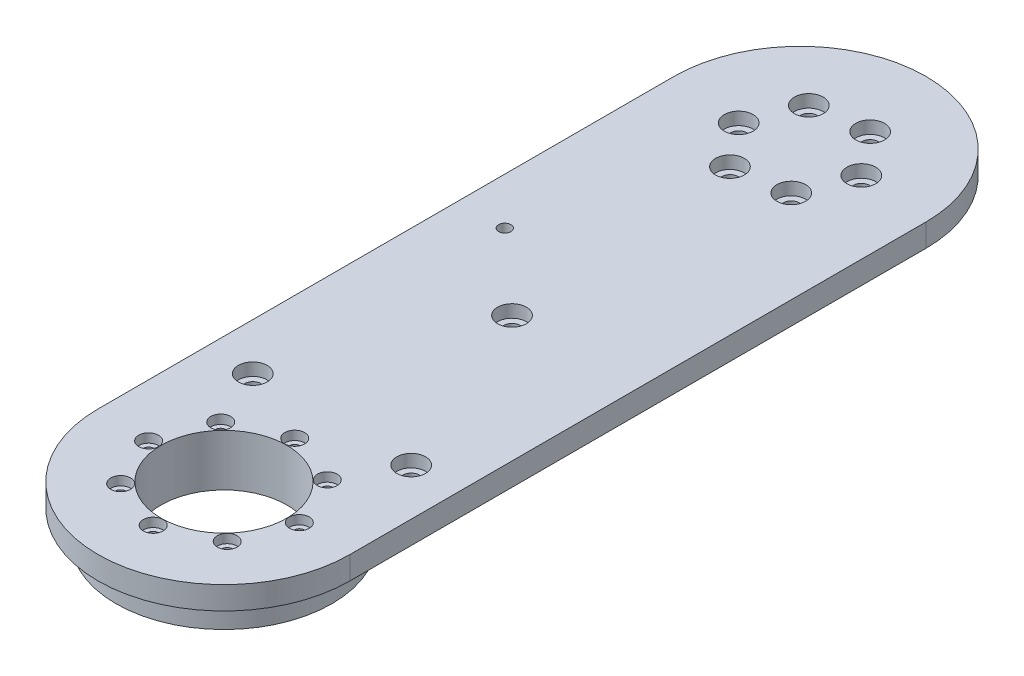
from build123d import *

# Parameters (mm, degrees)
PLACA_START                    = 46.75
SK_PLACA_W                     = 70
SK_PLACA_H                     = 160
PLACA_DEPTH                    = 6.35
EXTREMOS_START                 = 46.75
SK_EXTREMOS_R                  = 35
EXTREMOS_DEPTH                 = 6.35
PASANTES_M4_SEPARADORES_START  = 46.75
SK_PASANTES_M4_SEPARADORES_R   = 2.25
PASANTES_M4_SEPARADORES_DEPTH  = 6.35
ASIENTO_J3_START               = 38.75
SK_ASIENTO_J3_R                = 30
SK_ASIENTO_J3_R_2              = 17.5
ASIENTO_J3_DEPTH               = 8
PASO_ROTOR_J3_START            = 38.75
SK_PASO_ROTOR_J3_R             = 17.5
PASO_ROTOR_J3_DEPTH            = 14.35
PASANTES_M2_5_ESTATOR_J3_START = 38.75
SK_PASANTES_M2_5_ESTATOR_J3_R  = 1.45
PASANTES_M2_5_ESTATOR_J3_DEPTH = 14.35
CAJAS_M2_5_J3_START            = 50.6
SK_CAJAS_M2_5_J3_R             = 2.75
CAJAS_M2_5_J3_DEPTH            = 2.5
PASANTES_M4_SALIDA_J2_START    = 46.75
SK_PASANTES_M4_SALIDA_J2_R     = 2.25
PASANTES_M4_SALIDA_J2_DEPTH    = 6.35
CAJAS_M4_J2_START              = 49.6
SK_CAJAS_M4_J2_R               = 4
CAJAS_M4_J2_DEPTH              = 3.5
PASANTE_M3_CINCHO_START        = 46.75
SK_PASANTE_M3_CINCHO_R         = 1.7
PASANTE_M3_CINCHO_DEPTH        = 6.35
SK_CAJAS_M4_SEPARADORES_R      = 4
CAJAS_M4_SEPARADORES_DEPTH     = 3.5


with BuildPart() as part:
    # Sk_Placa → Placa (new body)
    with BuildSketch(Plane(origin=(0, 0, 0), x_dir=(1, 0, 0), z_dir=(0, 1, 0)).offset(PLACA_START)):
        with Locations((0, -250)):
            Rectangle(SK_PLACA_W, SK_PLACA_H)
    extrude(amount=PLACA_DEPTH)

    # Sk_Extremos → Extremos (add)
    with BuildSketch(Plane(origin=(0, 0, 0), x_dir=(1, 0, 0), z_dir=(0, 1, 0)).offset(EXTREMOS_START)):
        with Locations((0, -170)):
            Circle(SK_EXTREMOS_R)
        with Locations((0, -330)):
            Circle(SK_EXTREMOS_R)
    extrude(amount=EXTREMOS_DEPTH)

    # Sk_Pasantes_M4_separadores → Pasantes_M4_separadores (cut)
    with BuildSketch(Plane(origin=(0, 0, 0), x_dir=(1, 0, 0), z_dir=(0, 1, 0)).offset(PASANTES_M4_SEPARADORES_START)):
        with Locations(Location((0, -250, 0), (0, 0, 270))):
            Circle(SK_PASANTES_M4_SEPARADORES_R)
        with Locations(Location((-22, -300, 0), (0, 0, 270))):
            Circle(SK_PASANTES_M4_SEPARADORES_R)
        with Locations(Location((22, -300, 0), (0, 0, 270))):
            Circle(SK_PASANTES_M4_SEPARADORES_R)
    extrude(amount=PASANTES_M4_SEPARADORES_DEPTH, mode=Mode.SUBTRACT)

    # Sk_Asiento_J3 → Asiento_J3 (add)
    with BuildSketch(Plane(origin=(0, 0, 0), x_dir=(1, 0, 0), z_dir=(0, 1, 0)).offset(ASIENTO_J3_START)):
        with Locations(Location((0, -330, 0), (0, 0, 270))):
            Circle(SK_ASIENTO_J3_R)
        with Locations(Location((0, -330, 0), (0, 0, 270))):
            Circle(SK_ASIENTO_J3_R_2, mode=Mode.SUBTRACT)
    extrude(amount=ASIENTO_J3_DEPTH)

    # Sk_Paso_rotor_J3 → Paso_rotor_J3 (cut)
    with BuildSketch(Plane(origin=(0, 0, 0), x_dir=(1, 0, 0), z_dir=(0, 1, 0)).offset(PASO_ROTOR_J3_START)):
        with Locations(Location((0, -330, 0), (0, 0, 270))):
            Circle(SK_PASO_ROTOR_J3_R)
    extrude(amount=PASO_ROTOR_J3_DEPTH, mode=Mode.SUBTRACT)

    # Sk_Pasantes_M2-5_estator_J3 → Pasantes_M2-5_estator_J3 (cut)
    with BuildSketch(Plane(origin=(0, 0, 0), x_dir=(1, 0, 0), z_dir=(0, 1, 0)).offset(PASANTES_M2_5_ESTATOR_J3_START)):
        with Locations(Location((20.289983175, -329.362361591, 0), (0, 0, 270))):
            Circle(SK_PASANTES_M2_5_ESTATOR_J3_R)
        with Locations(Location((14.798063137, -343.89630625, 0), (0, 0, 270))):
            Circle(SK_PASANTES_M2_5_ESTATOR_J3_R)
        with Locations(Location((0.637638409, -350.289983175, 0), (0, 0, 270))):
            Circle(SK_PASANTES_M2_5_ESTATOR_J3_R)
        with Locations(Location((-13.89630625, -344.798063137, 0), (0, 0, 270))):
            Circle(SK_PASANTES_M2_5_ESTATOR_J3_R)
        with Locations(Location((-20.289983175, -330.637638409, 0), (0, 0, 270))):
            Circle(SK_PASANTES_M2_5_ESTATOR_J3_R)
        with Locations(Location((-14.798063137, -316.10369375, 0), (0, 0, 270))):
            Circle(SK_PASANTES_M2_5_ESTATOR_J3_R)
        with Locations(Location((-0.637638409, -309.710016825, 0), (0, 0, 270))):
            Circle(SK_PASANTES_M2_5_ESTATOR_J3_R)
        with Locations(Location((13.89630625, -315.201936863, 0), (0, 0, 270))):
            Circle(SK_PASANTES_M2_5_ESTATOR_J3_R)
    extrude(amount=PASANTES_M2_5_ESTATOR_J3_DEPTH, mode=Mode.SUBTRACT)

    # Sk_Cajas_M2-5_J3 → Cajas_M2-5_J3 (cut)
    with BuildSketch(Plane(origin=(0, 0, 0), x_dir=(1, 0, 0), z_dir=(0, 1, 0)).offset(CAJAS_M2_5_J3_START)):
        with Locations(Location((20.289983175, -329.362361591, 0), (0, 0, 270))):
            Circle(SK_CAJAS_M2_5_J3_R)
        with Locations(Location((14.798063137, -343.89630625, 0), (0, 0, 270))):
            Circle(SK_CAJAS_M2_5_J3_R)
        with Locations(Location((0.637638409, -350.289983175, 0), (0, 0, 270))):
            Circle(SK_CAJAS_M2_5_J3_R)
        with Locations(Location((-13.89630625, -344.798063137, 0), (0, 0, 270))):
            Circle(SK_CAJAS_M2_5_J3_R)
        with Locations(Location((-20.289983175, -330.637638409, 0), (0, 0, 270))):
            Circle(SK_CAJAS_M2_5_J3_R)
        with Locations(Location((-14.798063137, -316.10369375, 0), (0, 0, 270))):
            Circle(SK_CAJAS_M2_5_J3_R)
        with Locations(Location((-0.637638409, -309.710016825, 0), (0, 0, 270))):
            Circle(SK_CAJAS_M2_5_J3_R)
        with Locations(Location((13.89630625, -315.201936863, 0), (0, 0, 270))):
            Circle(SK_CAJAS_M2_5_J3_R)
    extrude(amount=CAJAS_M2_5_J3_DEPTH, mode=Mode.SUBTRACT)

    # Sk_Pasantes_M4_salida_J2 → Pasantes_M4_salida_J2 (cut)
    with BuildSketch(Plane(origin=(0, 0, 0), x_dir=(1, 0, 0), z_dir=(0, 1, 0)).offset(PASANTES_M4_SALIDA_J2_START)):
        with Locations(Location((14.839084994, -167.808754572, 0), (0, 0, 270))):
            Circle(SK_PASANTES_M4_SALIDA_J2_R)
        with Locations(Location((9.317216704, -181.75540186, 0), (0, 0, 270))):
            Circle(SK_PASANTES_M4_SALIDA_J2_R)
        with Locations(Location((-5.52186829, -183.946647288, 0), (0, 0, 270))):
            Circle(SK_PASANTES_M4_SALIDA_J2_R)
        with Locations(Location((-14.839084994, -172.191245428, 0), (0, 0, 270))):
            Circle(SK_PASANTES_M4_SALIDA_J2_R)
        with Locations(Location((-9.317216704, -158.24459814, 0), (0, 0, 270))):
            Circle(SK_PASANTES_M4_SALIDA_J2_R)
        with Locations(Location((5.52186829, -156.053352712, 0), (0, 0, 270))):
            Circle(SK_PASANTES_M4_SALIDA_J2_R)
    extrude(amount=PASANTES_M4_SALIDA_J2_DEPTH, mode=Mode.SUBTRACT)

    # Sk_Cajas_M4_J2 → Cajas_M4_J2 (cut)
    with BuildSketch(Plane(origin=(0, 0, 0), x_dir=(1, 0, 0), z_dir=(0, 1, 0)).offset(CAJAS_M4_J2_START)):
        with Locations(Location((14.839084994, -167.808754572, 0), (0, 0, 270))):
            Circle(SK_CAJAS_M4_J2_R)
        with Locations(Location((9.317216704, -181.75540186, 0), (0, 0, 270))):
            Circle(SK_CAJAS_M4_J2_R)
        with Locations(Location((-5.52186829, -183.946647288, 0), (0, 0, 270))):
            Circle(SK_CAJAS_M4_J2_R)
        with Locations(Location((-14.839084994, -172.191245428, 0), (0, 0, 270))):
            Circle(SK_CAJAS_M4_J2_R)
        with Locations(Location((-9.317216704, -158.24459814, 0), (0, 0, 270))):
            Circle(SK_CAJAS_M4_J2_R)
        with Locations(Location((5.52186829, -156.053352712, 0), (0, 0, 270))):
            Circle(SK_CAJAS_M4_J2_R)
    extrude(amount=CAJAS_M4_J2_DEPTH, mode=Mode.SUBTRACT)

    # Sk_Pasante_M3_cincho → Pasante_M3_cincho (cut)
    with BuildSketch(Plane(origin=(0, 0, 0), x_dir=(1, 0, 0), z_dir=(0, 1, 0)).offset(PASANTE_M3_CINCHO_START)):
        with Locations(Location((-22, -230, 0), (0, 0, 270))):
            Circle(SK_PASANTE_M3_CINCHO_R)
    extrude(amount=PASANTE_M3_CINCHO_DEPTH, mode=Mode.SUBTRACT)

    # Sk_Cajas_M4_separadores → Cajas_M4_separadores (cut)
    with BuildSketch(Plane(origin=(0, 53.1, 0), x_dir=(1, 0, 0), z_dir=(0, 1, 0))):
        with Locations(Location((0, -250, 0), (0, 0, 270))):
            Circle(SK_CAJAS_M4_SEPARADORES_R)
        with Locations(Location((22, -300, 0), (0, 0, 270))):
            Circle(SK_CAJAS_M4_SEPARADORES_R)
        with Locations(Location((-22, -300, 0), (0, 0, 270))):
            Circle(SK_CAJAS_M4_SEPARADORES_R)
    extrude(amount=-CAJAS_M4_SEPARADORES_DEPTH, mode=Mode.SUBTRACT)


solid = part.part
